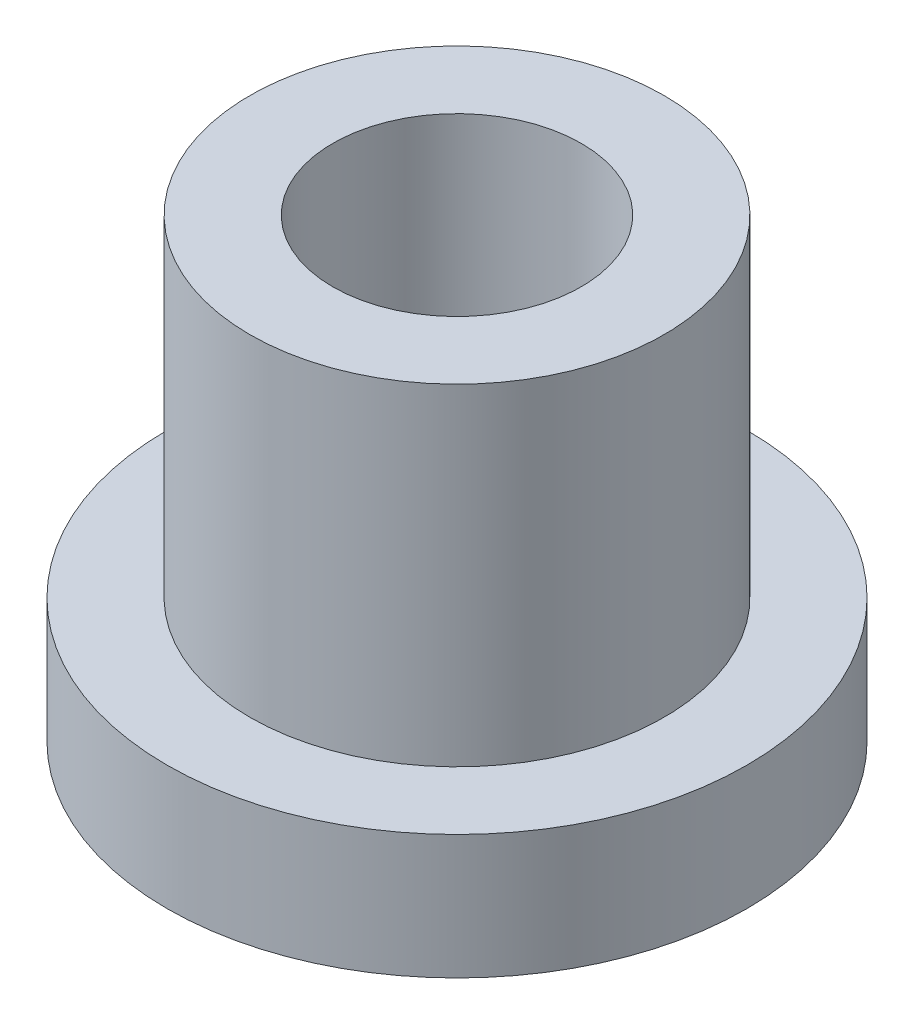
from build123d import *

# Parameters (mm, degrees)
IZIM3_R                     = 7
IZIM3_R_2                   = 3
Y_KSEKLIK_EKSTR_ZYON2_DEPTH = 3
IZIM4_R                     = 5
IZIM4_R_2                   = 3
Y_KSEKLIK_EKSTR_ZYON3_DEPTH = 8


with BuildPart() as part:
    # Çizim3 → Yükseklik-Ekstrüzyon2 (new body)
    with BuildSketch(Plane(origin=(0, 0, 0), x_dir=(1, 0, 0), z_dir=(0, 1, 0))):
        with Locations(Location((0, 0, 0), (0, 0, 270))):
            Circle(IZIM3_R)
        with Locations(Location((0, 0, 0), (0, 0, 270))):
            Circle(IZIM3_R_2, mode=Mode.SUBTRACT)
    extrude(amount=Y_KSEKLIK_EKSTR_ZYON2_DEPTH)

    # Çizim4 → Yükseklik-Ekstrüzyon3 (add)
    with BuildSketch(Plane(origin=(0, 3, 0), x_dir=(1, 0, 0), z_dir=(0, 1, 0))):
        with Locations(Location((0, 0, 0), (0, 0, 270))):
            Circle(IZIM4_R)
        with Locations(Location((0, 0, 0), (0, 0, 270))):
            Circle(IZIM4_R_2, mode=Mode.SUBTRACT)
    extrude(amount=Y_KSEKLIK_EKSTR_ZYON3_DEPTH)


solid = part.part
